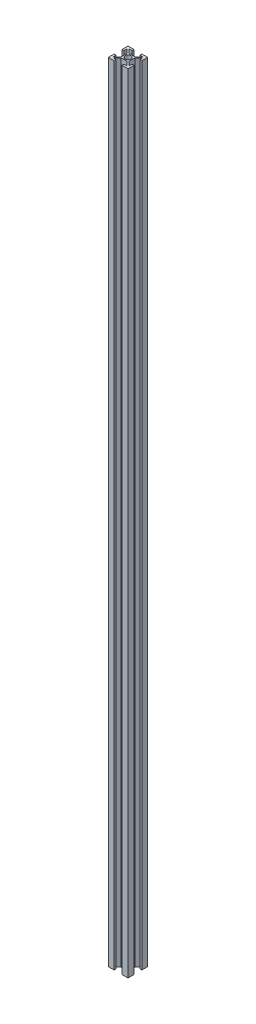
from build123d import *

# Parameters (mm, degrees)
F_2020_SKETCH_R     = 3
BOSS_EXTRUDE1_DEPTH = 800


with BuildPart() as part:
    # 2020 sketch → Boss-Extrude1 (new body)
    with BuildSketch(Plane(origin=(0, 0, 0), x_dir=(1, 0, 0), z_dir=(0, 1, 0))):
        Polygon((-4, 10), (-4, 8), (-7, 8), (-3, 4), (3, 4), (7, 8), (4, 8), (4, 10), (10, 10), (10, 4), (8, 4), (8, 7), (4, 3), (4, -3), (8, -7), (8, -4), (10, -4), (10, -10), (4, -10), (4, -8), (7, -8), (3, -4), (-3, -4), (-7, -8), (-4, -8), (-4, -10), (-10, -10), (-10, -4), (-8, -4), (-8, -7), (-4, -3), (-4, 3), (-8, 7), (-8, 4), (-10, 4), (-10, 10), align=None)
        with Locations(Location((0, 0, 0), (0, 0, 270))):
            Circle(F_2020_SKETCH_R, mode=Mode.SUBTRACT)
    extrude(amount=BOSS_EXTRUDE1_DEPTH)


solid = part.part
